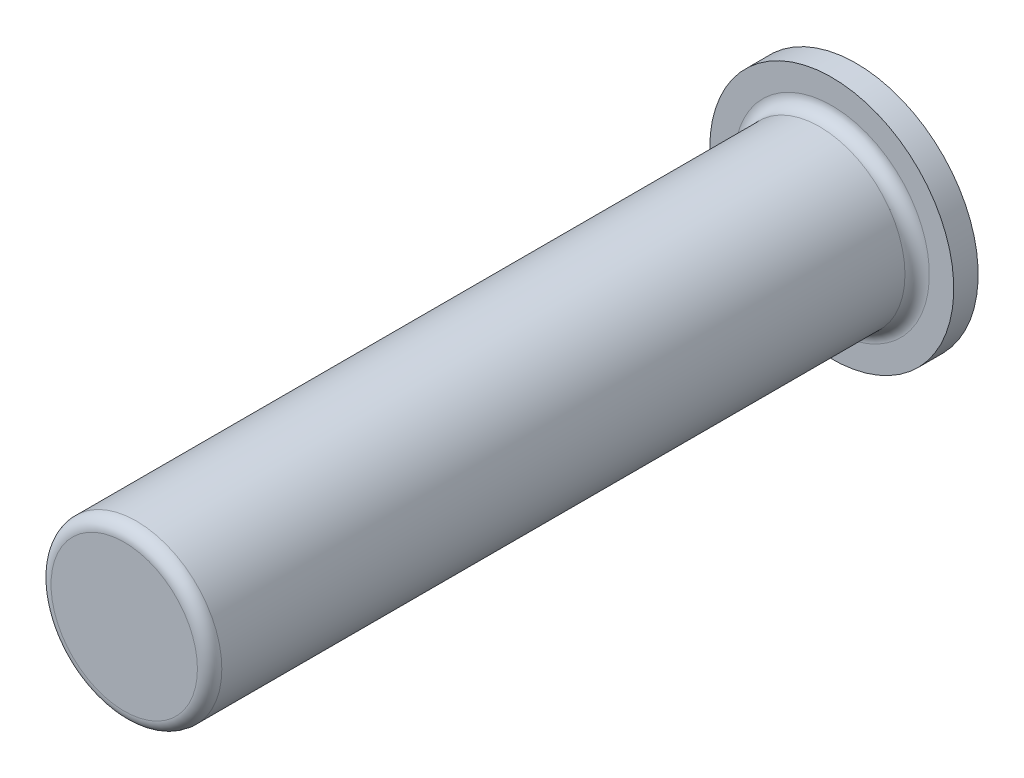
from build123d import *

# Parameters (mm, degrees)
SKETCH1_R           = 14
SKETCH1_R_2         = 7.5
BOSS_EXTRUDE1_DEPTH = 120
BOSS_EXTRUDE2_START = -10
SKETCH2_R           = 14
BOSS_EXTRUDE2_DEPTH = 10
SKETCH3_R           = 20
SKETCH3_R_2         = 7.5
BOSS_EXTRUDE3_DEPTH = 4
FILLET3_R           = 2


with BuildPart() as part:
    # Sketch1 → Boss-Extrude1 (new body)
    with BuildSketch(Plane.XY):
        Circle(SKETCH1_R)
        Circle(SKETCH1_R_2, mode=Mode.SUBTRACT)
    extrude(amount=BOSS_EXTRUDE1_DEPTH)

    # Sketch2 → Boss-Extrude2 (add)
    with BuildSketch(Plane.XY.offset(120).offset(BOSS_EXTRUDE2_START)):
        Circle(SKETCH2_R)
    extrude(amount=BOSS_EXTRUDE2_DEPTH)

    # Sketch3 → Boss-Extrude3 (add)
    with BuildSketch(Plane(origin=(0, 0, 0), x_dir=(-1, 0, 0), z_dir=(0, 0, -1))):
        Circle(SKETCH3_R)
        with Locations(Location((0, 0, 0), (0, 0, 180))):
            Circle(SKETCH3_R_2, mode=Mode.SUBTRACT)
    extrude(amount=-BOSS_EXTRUDE3_DEPTH)

    # Fillet3
    fillet3_edges = [part.edges().sort_by_distance(p)[0] for p in [
        (-14, 0, 4),
        (-14, 0, 120),
    ]]
    fillet(fillet3_edges, radius=FILLET3_R)


solid = part.part
